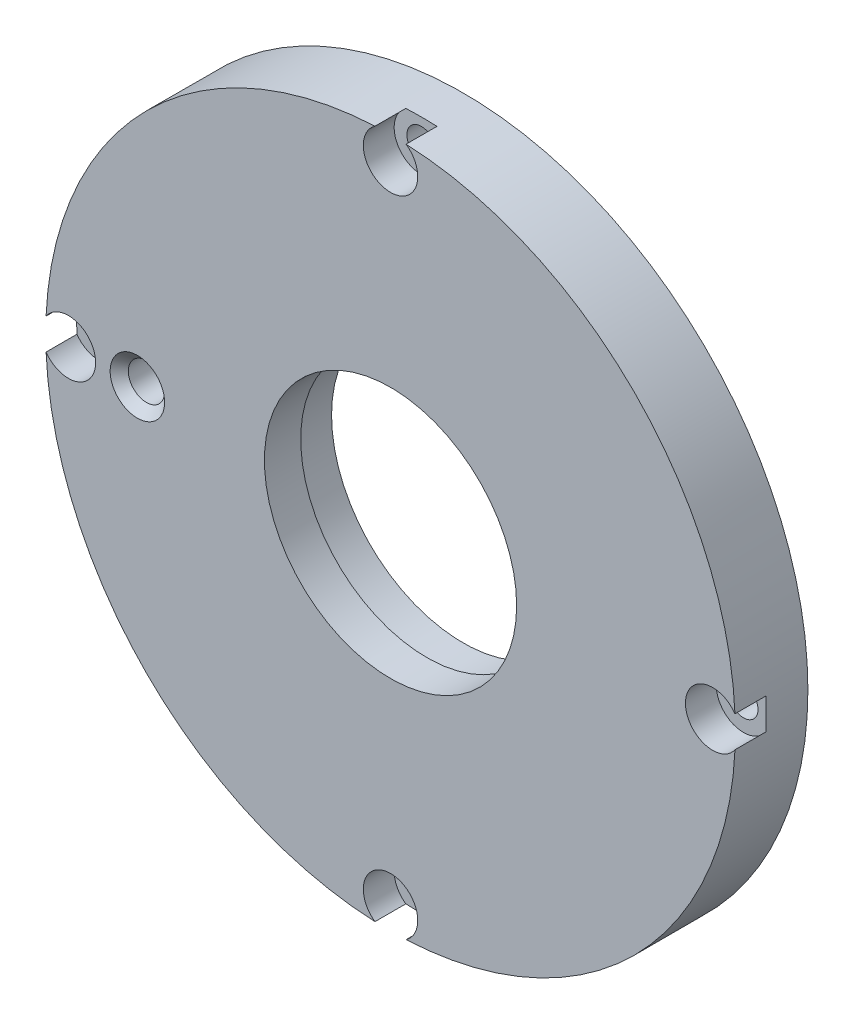
from build123d import *

# Parameters (mm, degrees)
SKETCH_1_R                = 38
SKETCH_1_R_2              = 13.9
EXTRUDE_1_DEPTH           = 8
HOLE_WIZARD_1_D           = 3.2
HOLE_WIZARD_1_CBORE_D     = 6
HOLE_WIZARD_1_CBORE_DEPTH = 3.4
HOLE_WIZARD_4_0_4_1_D     = 4
CHAMFER_1_SIZE            = 1
SKETCH_9_R                = 14.5
CUT_EXTRUDE_1_DEPTH       = 4


with BuildPart() as part:
    # 草图1 → 凸台-拉伸1 (new body)
    with BuildSketch(Plane.XY):
        Circle(SKETCH_1_R)
        Circle(SKETCH_1_R_2, mode=Mode.SUBTRACT)
    extrude(amount=EXTRUDE_1_DEPTH)

    # 打孔尺寸(%根据)内六角圆柱头螺钉的类型1 (through all)
    with Locations(Plane.XY.offset(8)):
        with Locations((0, 35.5), (35.5, 0), (0, -35.5), (-35.5, 0)):
            CounterBoreHole(HOLE_WIZARD_1_D / 2, HOLE_WIZARD_1_CBORE_D / 2, HOLE_WIZARD_1_CBORE_DEPTH)

    # Ø4.0 (4) 直径孔1 (through all)
    with Locations(Plane(origin=(0, 0, 0), x_dir=(-1, 0, 0), z_dir=(0, 0, -1))):
        with Locations((27.9, 0)):
            Hole(HOLE_WIZARD_4_0_4_1_D / 2)

    # 倒角1
    chamfer_1_edges = [part.edges().sort_by_distance(p)[0] for p in [
        (-29.9, 0, 0),
        (-29.9, 0, 8),
    ]]
    chamfer(chamfer_1_edges, length=CHAMFER_1_SIZE)

    # 草图9 → 切除-拉伸1 (cut)
    with BuildSketch(Plane.XY):
        Circle(SKETCH_9_R)
    extrude(amount=CUT_EXTRUDE_1_DEPTH, mode=Mode.SUBTRACT)


solid = part.part
